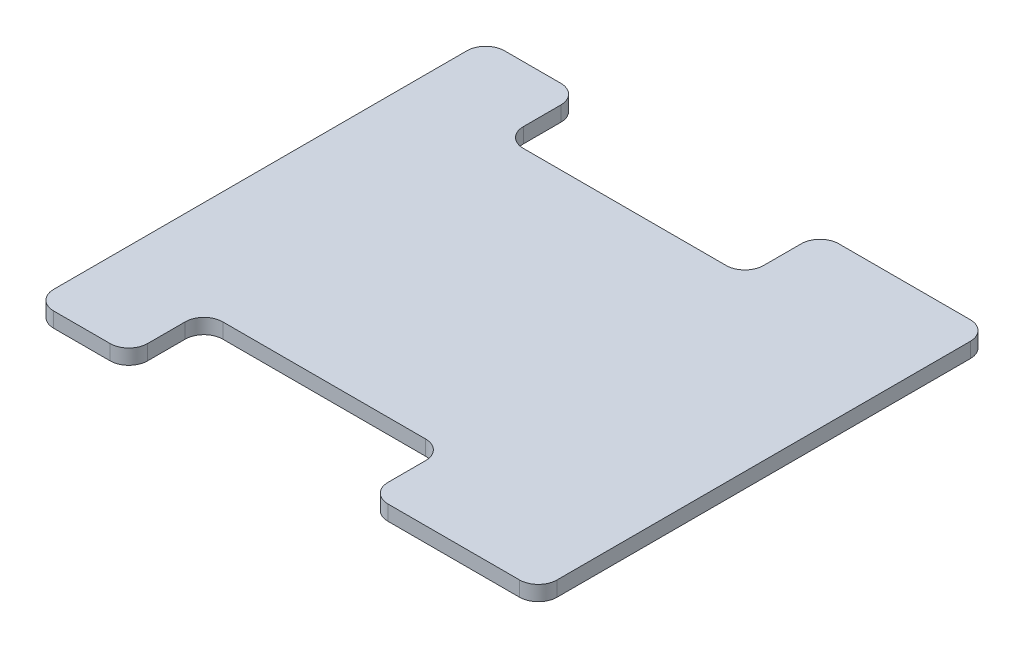
from build123d import *

# Parameters (mm, degrees)
RESSALTO_EXTRUS_O1_DEPTH = 4


with BuildPart() as part:
    # Esboço1 → Ressalto-extrusão1 (new body)
    with BuildSketch(Plane(origin=(0, 0, 0), x_dir=(1, 0, 0), z_dir=(0, 1, 0))):
        with BuildLine():
            Line((-47, -60), (-62, -60))
            ThreePointArc((-62, -60), (-65.535533906, -58.535533906), (-67, -55))
            Line((-67, -55), (-67, 55))
            ThreePointArc((-67, 55), (-65.535533906, 58.535533906), (-62, 60))
            Line((-62, 60), (-47, 60))
            ThreePointArc((-47, 60), (-43.464466094, 58.535533906), (-42, 55))
            Line((-42, 55), (-42, 45))
            ThreePointArc((-42, 45), (-40.535533906, 41.464466094), (-37, 40))
            Line((-37, 40), (17, 40))
            ThreePointArc((17, 40), (20.535533906, 41.464466094), (22, 45))
            Line((22, 45), (22, 55))
            ThreePointArc((22, 55), (23.464466094, 58.535533906), (27, 60))
            Line((27, 60), (62, 60))
            ThreePointArc((62, 60), (65.535533906, 58.535533906), (67, 55))
            Line((67, 55), (67, -55))
            ThreePointArc((67, -55), (65.535533906, -58.535533906), (62, -60))
            Line((62, -60), (27, -60))
            ThreePointArc((27, -60), (23.464466094, -58.535533906), (22, -55))
            Line((22, -55), (22, -45))
            ThreePointArc((22, -45), (20.535533906, -41.464466094), (17, -40))
            Line((17, -40), (-37, -40))
            ThreePointArc((-37, -40), (-40.535533906, -41.464466094), (-42, -45))
            Line((-42, -45), (-42, -55))
            ThreePointArc((-42, -55), (-43.464466094, -58.535533906), (-47, -60))
        make_face()
    extrude(amount=RESSALTO_EXTRUS_O1_DEPTH)


solid = part.part
